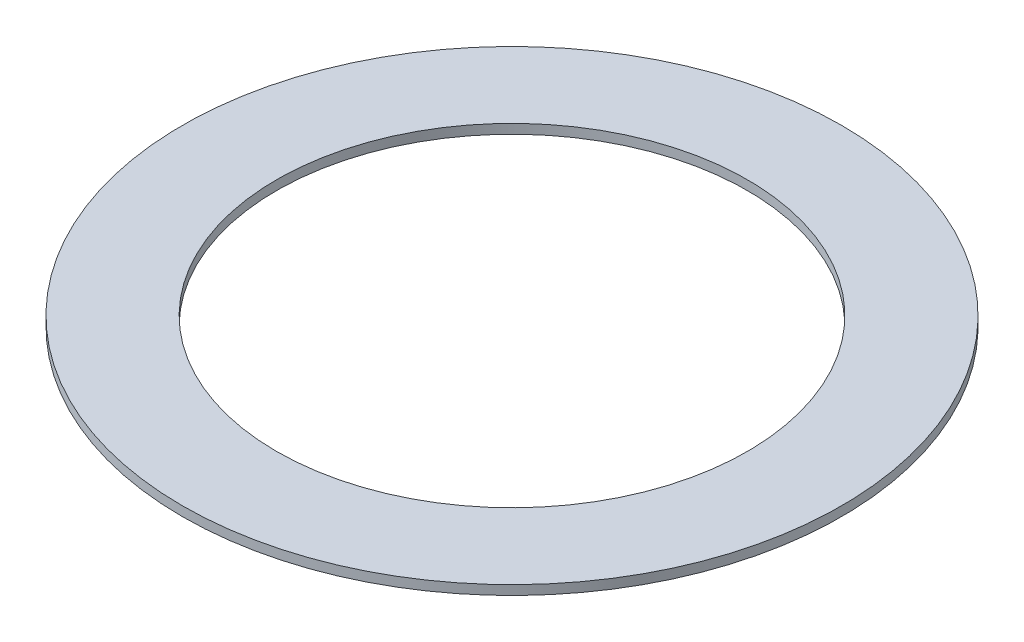
from build123d import *

# Parameters (mm, degrees)
ESQUISSE1_R        = 17.5
ESQUISSE1_R_2      = 12.5
BOSS_EXTRU_1_DEPTH = 0.5


with BuildPart() as part:
    # Esquisse1 → Boss.-Extru.1 (new body)
    with BuildSketch(Plane(origin=(0, 0, 0), x_dir=(1, 0, 0), z_dir=(0, 1, 0))):
        with Locations(Location((0, 0, 0), (0, 0, 270))):
            Circle(ESQUISSE1_R)
        with Locations(Location((0, 0, 0), (0, 0, 270))):
            Circle(ESQUISSE1_R_2, mode=Mode.SUBTRACT)
    extrude(amount=BOSS_EXTRU_1_DEPTH)


solid = part.part
